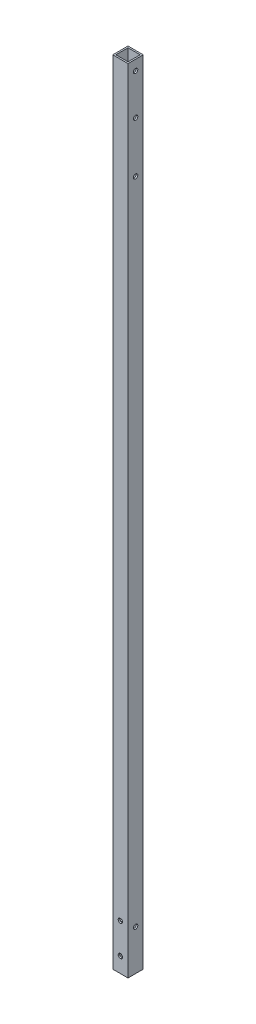
from build123d import *

# Parameters (mm, degrees)
SKETCH_1_W          = 15
SKETCH_1_H          = 15
SKETCH_1_W_2        = 12
SKETCH_1_H_2        = 12
EXTRUDE_1_DEPTH     = 780
CUT_EXTRUDE_1_REACH = 782.288
SKETCH_2_R          = 2.15
CUT_EXTRUDE_2_REACH = 782.288
SKETCH_4_R          = 2.15


with BuildPart() as part:
    # ｽｹｯﾁ1 → 押し出し-薄板1 (new body)
    with BuildSketch(Plane(origin=(0, 0, 0), x_dir=(1, 0, 0), z_dir=(0, 1, 0))):
        with Locations((7.5, 7.5)):
            Rectangle(SKETCH_1_W, SKETCH_1_H)
        with Locations((7.5, 7.5)):
            Rectangle(SKETCH_1_W_2, SKETCH_1_H_2, mode=Mode.SUBTRACT)
    extrude(amount=EXTRUDE_1_DEPTH)

    # ｶｯﾄ - 押し出し1: up to this face of the body (flat: up to its plane)
    cut_extrude_1_end = Plane(part.part.faces().sort_by_distance((0, 390, -7.5))[0])
    # ｽｹｯﾁ2 → ｶｯﾄ - 押し出し1 (cut, up to the picked face)
    with BuildSketch(Plane(origin=(15, 0, 0), x_dir=(0, 0, -1), z_dir=(1, 0, 0)), mode=Mode.PRIVATE) as cut_extrude_1_sk1:
        with Locations((7.5, 730)):
            Circle(SKETCH_2_R)
    cut_extrude_1_tool1 = split(extrude(cut_extrude_1_sk1.sketch, amount=-CUT_EXTRUDE_1_REACH, mode=Mode.PRIVATE), bisect_by=cut_extrude_1_end, keep=Keep.BOTH, mode=Mode.PRIVATE)
    # ｽｹｯﾁ2 → ｶｯﾄ - 押し出し1 (cut, up to the picked face)
    with BuildSketch(Plane(origin=(15, 0, 0), x_dir=(0, 0, -1), z_dir=(1, 0, 0)), mode=Mode.PRIVATE) as cut_extrude_1_sk2:
        with Locations((7.5, 680)):
            Circle(SKETCH_2_R)
    cut_extrude_1_tool2 = split(extrude(cut_extrude_1_sk2.sketch, amount=-CUT_EXTRUDE_1_REACH, mode=Mode.PRIVATE), bisect_by=cut_extrude_1_end, keep=Keep.BOTH, mode=Mode.PRIVATE)
    # ｽｹｯﾁ2 → ｶｯﾄ - 押し出し1 (cut, up to the picked face)
    with BuildSketch(Plane(origin=(15, 0, 0), x_dir=(0, 0, -1), z_dir=(1, 0, 0)), mode=Mode.PRIVATE) as cut_extrude_1_sk3:
        with Locations((7.5, 40)):
            Circle(SKETCH_2_R)
    cut_extrude_1_tool3 = split(extrude(cut_extrude_1_sk3.sketch, amount=-CUT_EXTRUDE_1_REACH, mode=Mode.PRIVATE), bisect_by=cut_extrude_1_end, keep=Keep.BOTH, mode=Mode.PRIVATE)
    # ｽｹｯﾁ2 → ｶｯﾄ - 押し出し1 (cut, up to the picked face)
    with BuildSketch(Plane(origin=(15, 0, 0), x_dir=(0, 0, -1), z_dir=(1, 0, 0)), mode=Mode.PRIVATE) as cut_extrude_1_sk4:
        with Locations((7.5, 770)):
            Circle(SKETCH_2_R)
    cut_extrude_1_tool4 = split(extrude(cut_extrude_1_sk4.sketch, amount=-CUT_EXTRUDE_1_REACH, mode=Mode.PRIVATE), bisect_by=cut_extrude_1_end, keep=Keep.BOTH, mode=Mode.PRIVATE)
    add(cut_extrude_1_tool1.solids().sort_by(Axis((15, 730, -7.5), (-1, 0, 0)))[0], mode=Mode.SUBTRACT)
    add(cut_extrude_1_tool2.solids().sort_by(Axis((15, 680, -7.5), (-1, 0, 0)))[0], mode=Mode.SUBTRACT)
    add(cut_extrude_1_tool3.solids().sort_by(Axis((15, 40, -7.5), (-1, 0, 0)))[0], mode=Mode.SUBTRACT)
    add(cut_extrude_1_tool4.solids().sort_by(Axis((15, 770, -7.5), (-1, 0, 0)))[0], mode=Mode.SUBTRACT)

    # ｶｯﾄ - 押し出し2: up to this face of the body (flat: up to its plane)
    cut_extrude_2_end = Plane(part.part.faces().sort_by_distance((7.5, 390, -15))[0])
    # ｽｹｯﾁ4 → ｶｯﾄ - 押し出し2 (cut, up to the picked face)
    with BuildSketch(Plane.XY, mode=Mode.PRIVATE) as cut_extrude_2_sk1:
        with Locations((7.5, 15)):
            Circle(SKETCH_4_R)
    cut_extrude_2_tool1 = split(extrude(cut_extrude_2_sk1.sketch, amount=-CUT_EXTRUDE_2_REACH, mode=Mode.PRIVATE), bisect_by=cut_extrude_2_end, keep=Keep.BOTH, mode=Mode.PRIVATE)
    # ｽｹｯﾁ4 → ｶｯﾄ - 押し出し2 (cut, up to the picked face)
    with BuildSketch(Plane.XY, mode=Mode.PRIVATE) as cut_extrude_2_sk2:
        with Locations((7.5, 45)):
            Circle(SKETCH_4_R)
    cut_extrude_2_tool2 = split(extrude(cut_extrude_2_sk2.sketch, amount=-CUT_EXTRUDE_2_REACH, mode=Mode.PRIVATE), bisect_by=cut_extrude_2_end, keep=Keep.BOTH, mode=Mode.PRIVATE)
    add(cut_extrude_2_tool1.solids().sort_by(Axis((7.5, 15, 0), (0, 0, -1)))[0], mode=Mode.SUBTRACT)
    add(cut_extrude_2_tool2.solids().sort_by(Axis((7.5, 45, 0), (0, 0, -1)))[0], mode=Mode.SUBTRACT)


solid = part.part
